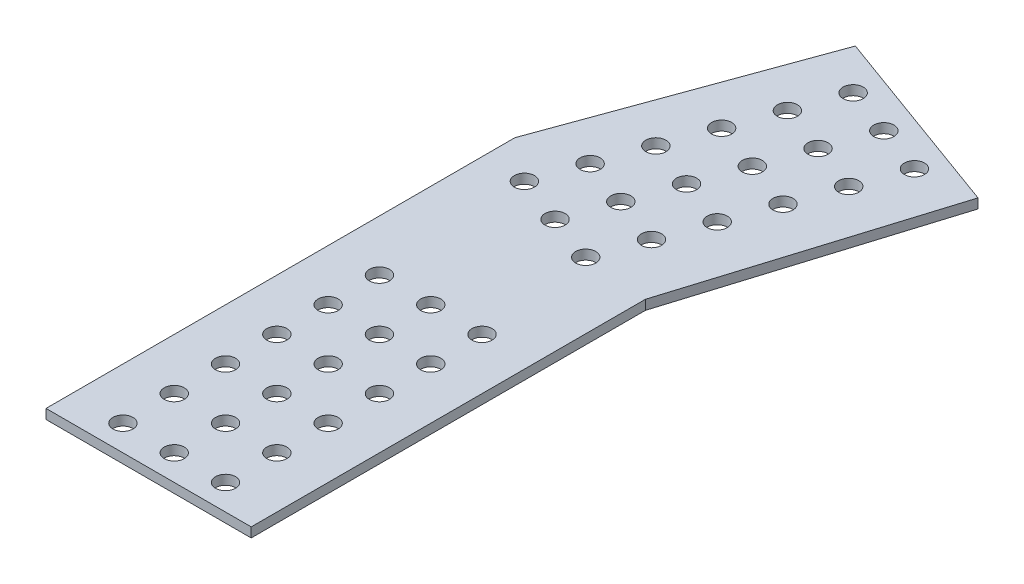
from build123d import *

# Parameters (mm, degrees)
SKETCH1_W           = 50.8
SKETCH1_H           = 76.2
SKETCH1_R           = 2.4892
BOSS_EXTRUDE1_DEPTH = 2.38125


with BuildPart() as part:
    # Sketch1 → Boss-Extrude1 (new body)
    # profile 1 of 3: a face of its own
    with BuildSketch(Plane(origin=(0, 0, 0), x_dir=(1, 0, 0), z_dir=(0, 1, 0))):
        with Locations((-99.145518613, -345.905622456)):
            Rectangle(SKETCH1_W, SKETCH1_H)
        with Locations(Location((-86.445518613, -326.855622456, 0), (0, 0, 90))):
            Circle(SKETCH1_R, mode=Mode.SUBTRACT)
        with Locations(Location((-86.445518613, -352.255622456, 0), (0, 0, 90))):
            Circle(SKETCH1_R, mode=Mode.SUBTRACT)
        with Locations(Location((-86.445518613, -377.655622456, 0), (0, 0, 90))):
            Circle(SKETCH1_R, mode=Mode.SUBTRACT)
        with Locations(Location((-99.145518613, -326.855622456, 0), (0, 0, 90))):
            Circle(SKETCH1_R, mode=Mode.SUBTRACT)
        with Locations(Location((-99.145518613, -352.255622456, 0), (0, 0, 90))):
            Circle(SKETCH1_R, mode=Mode.SUBTRACT)
        with Locations(Location((-99.145518613, -377.655622456, 0), (0, 0, 90))):
            Circle(SKETCH1_R, mode=Mode.SUBTRACT)
        with Locations(Location((-111.845518613, -377.655622456, 0), (0, 0, 90))):
            Circle(SKETCH1_R, mode=Mode.SUBTRACT)
        with Locations(Location((-111.845518613, -364.955622456, 0), (0, 0, 90))):
            Circle(SKETCH1_R, mode=Mode.SUBTRACT)
        with Locations(Location((-111.845518613, -352.255622456, 0), (0, 0, 90))):
            Circle(SKETCH1_R, mode=Mode.SUBTRACT)
        with Locations(Location((-111.845518613, -339.555622456, 0), (0, 0, 90))):
            Circle(SKETCH1_R, mode=Mode.SUBTRACT)
        with Locations(Location((-111.845518613, -326.855622456, 0), (0, 0, 90))):
            Circle(SKETCH1_R, mode=Mode.SUBTRACT)
        with Locations(Location((-111.845518613, -314.155622456, 0), (0, 0, 90))):
            Circle(SKETCH1_R, mode=Mode.SUBTRACT)
        with Locations(Location((-99.145518613, -364.955622456, 0), (0, 0, 90))):
            Circle(SKETCH1_R, mode=Mode.SUBTRACT)
        with Locations(Location((-99.145518613, -339.555622456, 0), (0, 0, 90))):
            Circle(SKETCH1_R, mode=Mode.SUBTRACT)
        with Locations(Location((-99.145518613, -314.155622456, 0), (0, 0, 90))):
            Circle(SKETCH1_R, mode=Mode.SUBTRACT)
        with Locations(Location((-86.445518613, -364.955622456, 0), (0, 0, 90))):
            Circle(SKETCH1_R, mode=Mode.SUBTRACT)
        with Locations(Location((-86.445518613, -339.555622456, 0), (0, 0, 90))):
            Circle(SKETCH1_R, mode=Mode.SUBTRACT)
        with Locations(Location((-86.445518613, -314.155622456, 0), (0, 0, 90))):
            Circle(SKETCH1_R, mode=Mode.SUBTRACT)
    # profile 2 of 3: a face of its own
    with BuildSketch(Plane(origin=(0, 0, 0), x_dir=(1, 0, 0), z_dir=(0, 1, 0))):
        Polygon((-73.745518613, -307.805622456), (-124.545518613, -307.805622456), (-124.545518613, -267.92136832), (-73.745518613, -286.411056221), align=None)
        with Locations(Location((-102.075911776, -280.451262674, 0), (0, 0, 90))):
            Circle(SKETCH1_R, mode=Mode.SUBTRACT)
        with Locations(Location((-114.01000806, -276.107606853, 0), (0, 0, 90))):
            Circle(SKETCH1_R, mode=Mode.SUBTRACT)
        with Locations(Location((-90.141815492, -284.794918494, 0), (0, 0, 90))):
            Circle(SKETCH1_R, mode=Mode.SUBTRACT)
    # profile 3 of 3: a face of its own
    with BuildSketch(Plane(origin=(0, 0, 0), x_dir=(1, 0, 0), z_dir=(0, 1, 0))):
        Polygon((-124.545518613, -267.92136832), (-73.745518613, -286.411056221), (-54.317612196, -223.501044752), (-102.053997332, -206.126421471), align=None)
        with Locations(Location((-72.767192211, -237.058533358, 0), (0, 0, 90))):
            Circle(SKETCH1_R, mode=Mode.SUBTRACT)
        with Locations(Location((-81.454503851, -260.926725926, 0), (0, 0, 90))):
            Circle(SKETCH1_R, mode=Mode.SUBTRACT)
        with Locations(Location((-80.357632674, -220.780781254, 0), (0, 0, 90))):
            Circle(SKETCH1_R, mode=Mode.SUBTRACT)
        with Locations(Location((-89.044944315, -244.648973822, 0), (0, 0, 90))):
            Circle(SKETCH1_R, mode=Mode.SUBTRACT)
        with Locations(Location((-97.732255955, -268.51716639, 0), (0, 0, 90))):
            Circle(SKETCH1_R, mode=Mode.SUBTRACT)
        with Locations(Location((-109.666352239, -264.173510569, 0), (0, 0, 90))):
            Circle(SKETCH1_R, mode=Mode.SUBTRACT)
        with Locations(Location((-105.322696419, -252.239414285, 0), (0, 0, 90))):
            Circle(SKETCH1_R, mode=Mode.SUBTRACT)
        with Locations(Location((-100.979040599, -240.305318001, 0), (0, 0, 90))):
            Circle(SKETCH1_R, mode=Mode.SUBTRACT)
        with Locations(Location((-96.635384779, -228.371221717, 0), (0, 0, 90))):
            Circle(SKETCH1_R, mode=Mode.SUBTRACT)
        with Locations(Location((-92.291728958, -216.437125433, 0), (0, 0, 90))):
            Circle(SKETCH1_R, mode=Mode.SUBTRACT)
        with Locations(Location((-93.388600135, -256.583070106, 0), (0, 0, 90))):
            Circle(SKETCH1_R, mode=Mode.SUBTRACT)
        with Locations(Location((-84.701288495, -232.714877538, 0), (0, 0, 90))):
            Circle(SKETCH1_R, mode=Mode.SUBTRACT)
        with Locations(Location((-85.798159671, -272.86082221, 0), (0, 0, 90))):
            Circle(SKETCH1_R, mode=Mode.SUBTRACT)
        with Locations(Location((-77.110848031, -248.992629642, 0), (0, 0, 90))):
            Circle(SKETCH1_R, mode=Mode.SUBTRACT)
        with Locations(Location((-68.42353639, -225.124437074, 0), (0, 0, 90))):
            Circle(SKETCH1_R, mode=Mode.SUBTRACT)
    extrude(amount=BOSS_EXTRUDE1_DEPTH)


solid = part.part
